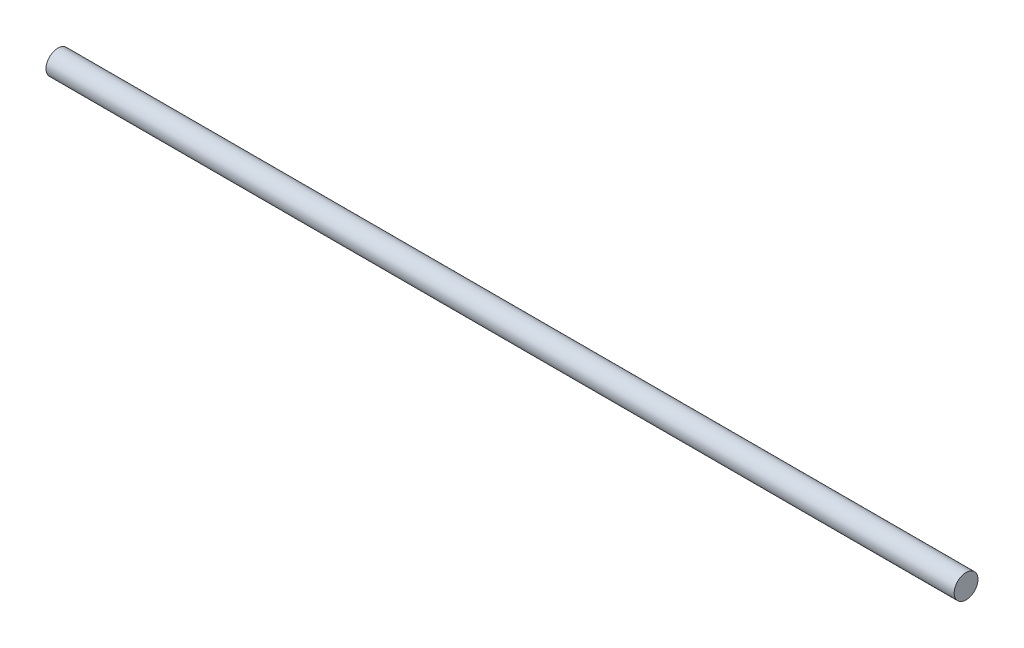
from build123d import *

# Parameters (mm, degrees)
SKETCH_1_R      = 4
EXTRUDE_1_DEPTH = 305


with BuildPart() as part:
    # 草图1 → 凸台-拉伸1 (new body)
    with BuildSketch(Plane(origin=(0, 0, 0), x_dir=(0, 0, -1), z_dir=(1, 0, 0))):
        Circle(SKETCH_1_R)
    extrude(amount=EXTRUDE_1_DEPTH)


solid = part.part
